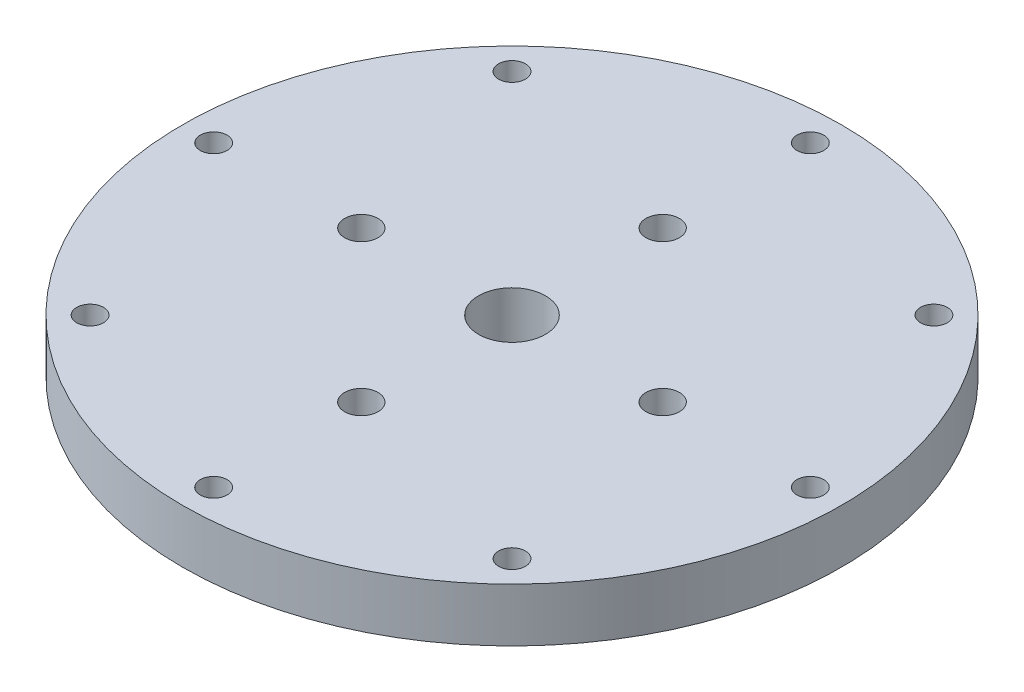
from build123d import *

# Parameters (mm, degrees)
SKETCH1_R           = 49.2125
SKETCH1_R_2         = 5
SKETCH1_R_3         = 2
SKETCH1_R_4         = 2.5
BOSS_EXTRUDE1_DEPTH = 8.001


with BuildPart() as part:
    # Sketch1 → Boss-Extrude1 (new body)
    with BuildSketch(Plane(origin=(0, 0, 0), x_dir=(1, 0, 0), z_dir=(0, 1, 0))):
        with Locations(Location((0, 0, 0), (0, 0, 270))):
            Circle(SKETCH1_R)
        with Locations(Location((0, 0, 0), (0, 0, 270))):
            Circle(SKETCH1_R_2, mode=Mode.SUBTRACT)
        with Locations(Location((-44.5516, 0, 0), (0, 0, 270))):
            Circle(SKETCH1_R_3, mode=Mode.SUBTRACT)
        with Locations(Location((-31.502738473, 31.502738473, 0), (0, 0, 270))):
            Circle(SKETCH1_R_3, mode=Mode.SUBTRACT)
        with Locations(Location((0, 44.5516, 0), (0, 0, 270))):
            Circle(SKETCH1_R_3, mode=Mode.SUBTRACT)
        with Locations(Location((-31.502738473, -31.502738473, 0), (0, 0, 270))):
            Circle(SKETCH1_R_3, mode=Mode.SUBTRACT)
        with Locations(Location((0, -44.5516, 0), (0, 0, 270))):
            Circle(SKETCH1_R_3, mode=Mode.SUBTRACT)
        with Locations(Location((31.502738473, -31.502738473, 0), (0, 0, 270))):
            Circle(SKETCH1_R_3, mode=Mode.SUBTRACT)
        with Locations(Location((44.5516, 0, 0), (0, 0, 270))):
            Circle(SKETCH1_R_3, mode=Mode.SUBTRACT)
        with Locations(Location((31.502738473, 31.502738473, 0), (0, 0, 270))):
            Circle(SKETCH1_R_3, mode=Mode.SUBTRACT)
        with Locations(Location((-22.5044, 0, 0), (0, 0, 270))):
            Circle(SKETCH1_R_4, mode=Mode.SUBTRACT)
        with Locations(Location((0, 22.5044, 0), (0, 0, 270))):
            Circle(SKETCH1_R_4, mode=Mode.SUBTRACT)
        with Locations(Location((22.5044, 0, 0), (0, 0, 270))):
            Circle(SKETCH1_R_4, mode=Mode.SUBTRACT)
        with Locations(Location((0, -22.5044, 0), (0, 0, 270))):
            Circle(SKETCH1_R_4, mode=Mode.SUBTRACT)
    extrude(amount=BOSS_EXTRUDE1_DEPTH)


solid = part.part
